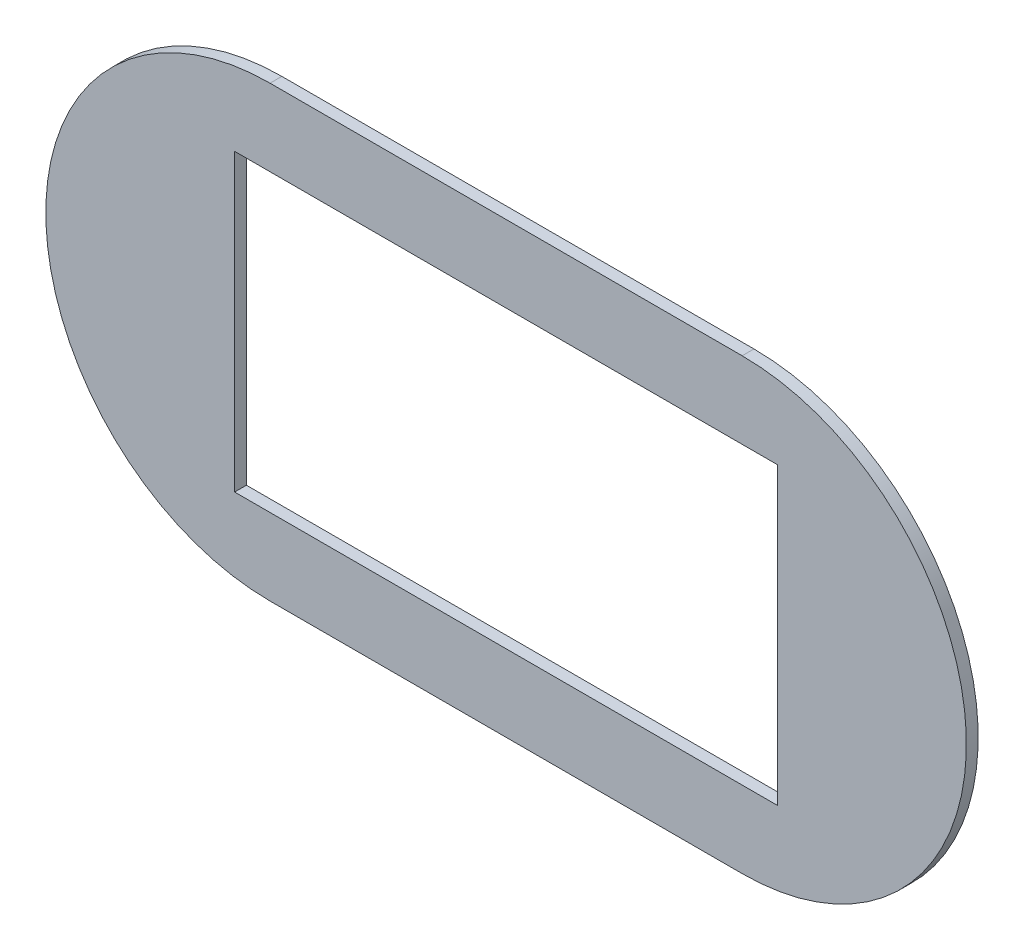
from build123d import *

# Parameters (mm, degrees)
EXTRUDE_1_DEPTH     = 2
SKETCH_2_W          = 92
SKETCH_2_H          = 50
CUT_EXTRUDE_1_DEPTH = 87.787095815


with BuildPart() as part:
    # Эскиз1 → Бобышка-Вытянуть1 (new body)
    with BuildSketch(Plane.XY):
        with BuildLine():
            Line((-40, 38), (40, 38))
            ThreePointArc((40, 38), (78, 0), (40, -38))
            Line((40, -38), (-40, -38))
            ThreePointArc((-40, -38), (-78, 0), (-40, 38))
        make_face()
    extrude(amount=EXTRUDE_1_DEPTH)

    # Эскиз2 → Вырез-Вытянуть1 (cut, through all)
    with BuildSketch(Plane.XY.offset(2)):
        Rectangle(SKETCH_2_W, SKETCH_2_H)
    extrude(amount=-CUT_EXTRUDE_1_DEPTH, mode=Mode.SUBTRACT)


solid = part.part
